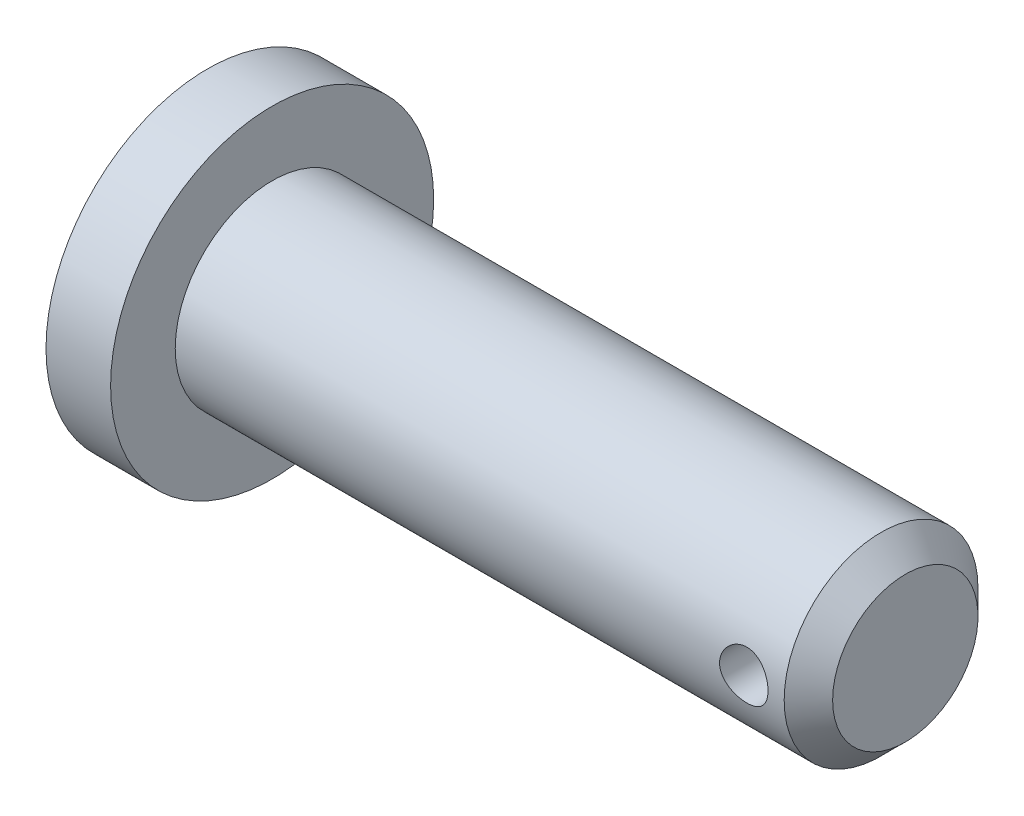
from build123d import *

# Parameters (mm, degrees)
CUT_EXTRUDE1_DEPTH      = 41.98579449
CUT_EXTRUDE1_DEPTH_BACK = 41.98579449
SKETCH2_R               = 2.38125
CHAMFER1_SIZE           = 2.38125


with BuildPart() as part:
    # Sketch1 → Pin Body (revolve)
    with BuildSketch(Plane.XY, mode=Mode.PRIVATE) as pin_body_sk:
        Polygon((-34.29, 0), (-34.29, 15.875), (-27.94, 15.875), (-27.94, 9.525), (34.29, 9.525), (34.29, 0), align=None)
    revolve(pin_body_sk.sketch.rotate(Axis((-34.29, 0, 0), (1, 0, 0)), 90), axis=Axis((-34.29, 0, 0), (1, 0, 0)))

    # Sketch2 → Cut-Extrude1 (cut, two sides: drawn at the far end of the back side and taken through both)
    with BuildSketch(Plane.XY.offset(-CUT_EXTRUDE1_DEPTH_BACK)):
        with Locations((27.94, 0)):
            Circle(SKETCH2_R)
    extrude(amount=CUT_EXTRUDE1_DEPTH + CUT_EXTRUDE1_DEPTH_BACK, mode=Mode.SUBTRACT)

    # Chamfer1
    chamfer1_edges = [part.edges().sort_by_distance(p)[0] for p in [
        (34.29, 0, -9.525),
    ]]
    chamfer(chamfer1_edges, length=CHAMFER1_SIZE)


solid = part.part
